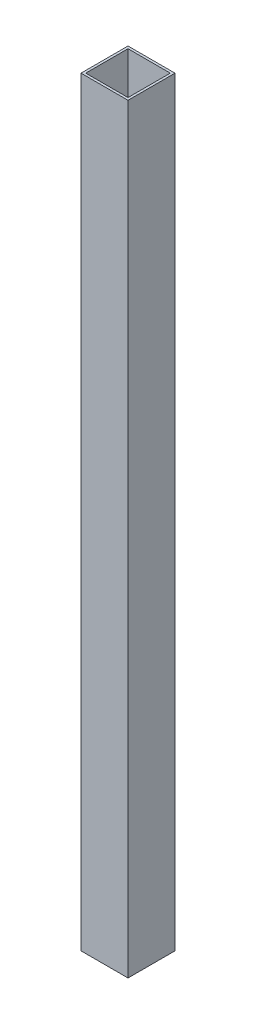
from build123d import *

# Parameters (mm, degrees)
SKETCH1_W           = 25.4
SKETCH1_H           = 25.4
SKETCH1_W_2         = 22.86
SKETCH1_H_2         = 22.86
BOSS_EXTRUDE1_DEPTH = 410.8


with BuildPart() as part:
    # Sketch1 → Boss-Extrude1 (new body)
    with BuildSketch(Plane(origin=(0, 0, 0), x_dir=(1, 0, 0), z_dir=(0, 1, 0))):
        with Locations((12.7, 12.7)):
            Rectangle(SKETCH1_W, SKETCH1_H)
        with Locations((12.7, 12.7)):
            Rectangle(SKETCH1_W_2, SKETCH1_H_2, mode=Mode.SUBTRACT)
    extrude(amount=BOSS_EXTRUDE1_DEPTH)


solid = part.part
